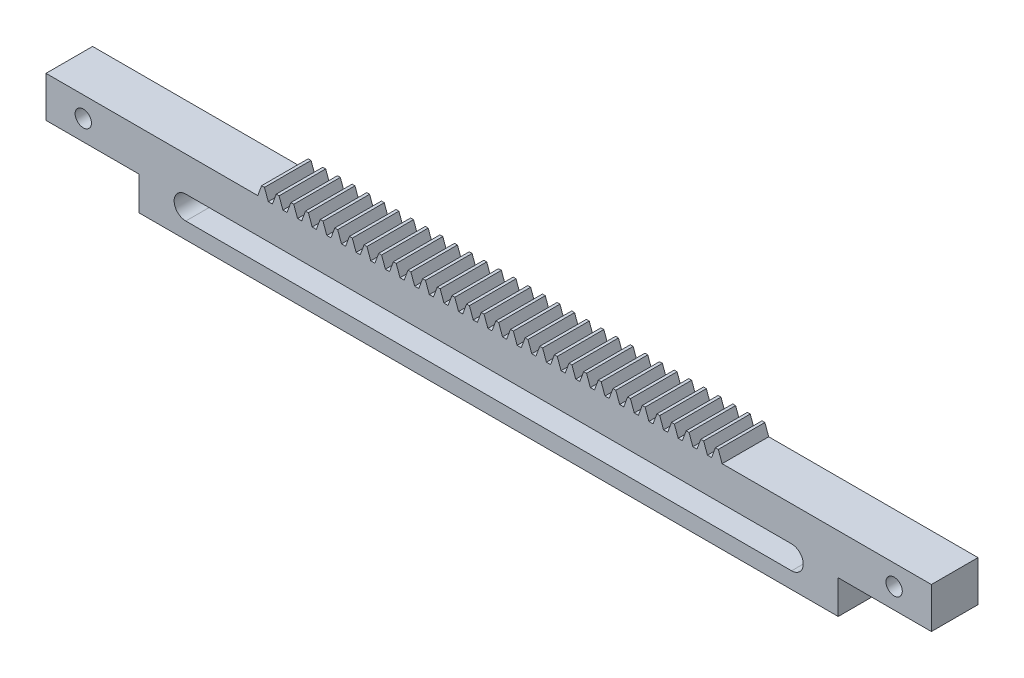
from build123d import *

# Parameters (mm, degrees)
BLANKSKE_W          = 100
BLANKSKE_H          = 11
BLANK_DEPTH         = 10
TOOTHCUTSIM_DEPTH   = 102.098961419
TEETHCUTS_COUNT     = 33
TEETHCUTS_PITCH     = 3.14159265
SKETCH1_W           = 10
SKETCH1_H           = 8.987737656
BOSS_EXTRUDE1_DEPTH = 45
SKETCH2_W           = 10
SKETCH2_H           = 8.75
BOSS_EXTRUDE2_DEPTH = 45
SKETCH3_R           = 1.75
CUT_EXTRUDE1_DEPTH  = 146.760076839
SKETCH4_W           = 150
SKETCH4_H           = 10
BOSS_EXTRUDE3_DEPTH = 7.2
CUT_EXTRUDE2_DEPTH  = 146.760076839
CUT_EXTRUDE3_DEPTH  = 146.760076839


with BuildPart() as part:
    # BlankSke → Blank (new body)
    with BuildSketch(Plane.XY):
        with Locations((50, 5.5)):
            Rectangle(BLANKSKE_W, BLANKSKE_H)
    extrude(amount=-BLANK_DEPTH)

    # TooCutSkeSim → ToothCutSim (cut, through all)
    with BuildSketch(Plane.XY):
        Polygon((0.44443537, 8.75), (-0.44443537, 8.75), (-1.272613241, 11.0254), (1.272613241, 11.0254), align=None)
    toothcutsim = extrude(amount=-TOOTHCUTSIM_DEPTH, mode=Mode.SUBTRACT)

    # TeethCuts: ToothCutSim ×33
    with Locations(*[(i * TEETHCUTS_PITCH, 0, 0) for i in range(1, TEETHCUTS_COUNT)]):
        add(toothcutsim, mode=Mode.SUBTRACT)

    # Sketch1 → Boss-Extrude1 (add)
    with BuildSketch(Plane(origin=(100, 0, 0), x_dir=(0, 0, -1), z_dir=(1, 0, 0))):
        with Locations((5, 4.493868828)):
            Rectangle(SKETCH1_W, SKETCH1_H)
    extrude(amount=BOSS_EXTRUDE1_DEPTH)

    # Sketch2 → Boss-Extrude2 (add)
    with BuildSketch(Plane.ZY):
        with Locations((-5, 4.375)):
            Rectangle(SKETCH2_W, SKETCH2_H)
    extrude(amount=BOSS_EXTRUDE2_DEPTH)

    # Sketch3 → Cut-Extrude1 (cut, through all)
    with BuildSketch(Plane(origin=(0, 0, -10), x_dir=(-1, 0, 0), z_dir=(0, 0, -1))):
        with Locations((-137, 4.375)):
            Circle(SKETCH3_R)
        with Locations((37, 4.375)):
            Circle(SKETCH3_R)
    extrude(amount=-CUT_EXTRUDE1_DEPTH, mode=Mode.SUBTRACT)

    # Sketch4 → Boss-Extrude3 (add)
    with BuildSketch(Plane.XZ):
        with Locations((50, -5)):
            Rectangle(SKETCH4_W, SKETCH4_H)
    extrude(amount=BOSS_EXTRUDE3_DEPTH)

    # Sketch5 → Cut-Extrude2 (cut, through all)
    with BuildSketch(Plane.XY):
        with BuildLine():
            Line((-15, 1.3), (115, 1.3))
            ThreePointArc((115, 1.3), (117.5, -1.2), (115, -3.7))
            Line((115, -3.7), (-15, -3.7))
            ThreePointArc((-15, -3.7), (-17.5, -1.2), (-15, 1.3))
        make_face()
    extrude(amount=-CUT_EXTRUDE2_DEPTH, mode=Mode.SUBTRACT)

    # Sketch6 → Cut-Extrude3 (cut, through all)
    with BuildSketch(Plane.XY):
        Polygon((100, 8.987737656), (100.08652943, 8.75), (145, 8.75), (145, 8.987737656), align=None)
    extrude(amount=-CUT_EXTRUDE3_DEPTH, mode=Mode.SUBTRACT)


solid = part.part
